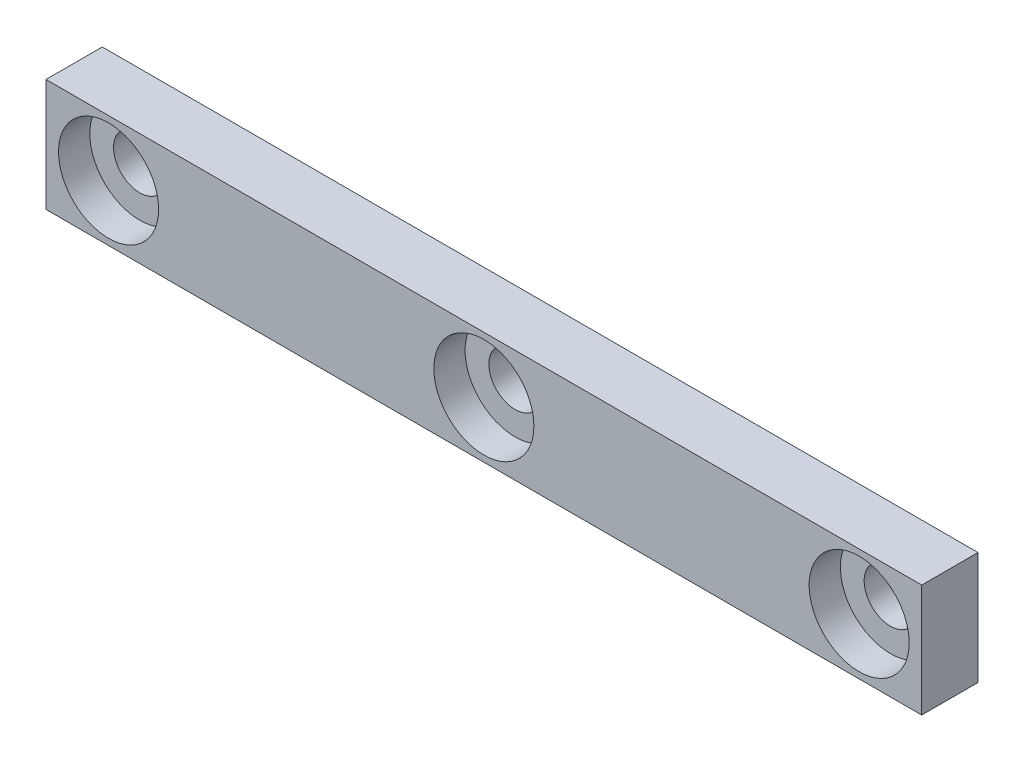
from build123d import *

# Parameters (mm, degrees)
SKETCH_1_W          = 70
SKETCH_1_H          = 9
SKETCH_1_R          = 2.1
EXTRUDE_1_DEPTH     = 4.5
SKETCH_3_R          = 4
CUT_EXTRUDE_1_DEPTH = 2.5


with BuildPart() as part:
    # 草圖1 → 填料-伸長1 (new body)
    with BuildSketch(Plane.XY):
        with Locations((15.64232849, -1.657407407)):
            Rectangle(SKETCH_1_W, SKETCH_1_H)
        with Locations((-14.35767151, -1.657407407)):
            Circle(SKETCH_1_R, mode=Mode.SUBTRACT)
        with Locations((15.64232849, -1.657407407)):
            Circle(SKETCH_1_R, mode=Mode.SUBTRACT)
        with Locations((45.64232849, -1.657407407)):
            Circle(SKETCH_1_R, mode=Mode.SUBTRACT)
    extrude(amount=EXTRUDE_1_DEPTH)

    # 草圖3 → 除料-伸長1 (cut)
    with BuildSketch(Plane.XY.offset(4.5)):
        with Locations((-14.35767151, -1.657407407)):
            Circle(SKETCH_3_R)
        with Locations((15.64232849, -1.657407407)):
            Circle(SKETCH_3_R)
        with Locations((45.64232849, -1.657407407)):
            Circle(SKETCH_3_R)
    extrude(amount=-CUT_EXTRUDE_1_DEPTH, mode=Mode.SUBTRACT)


solid = part.part
